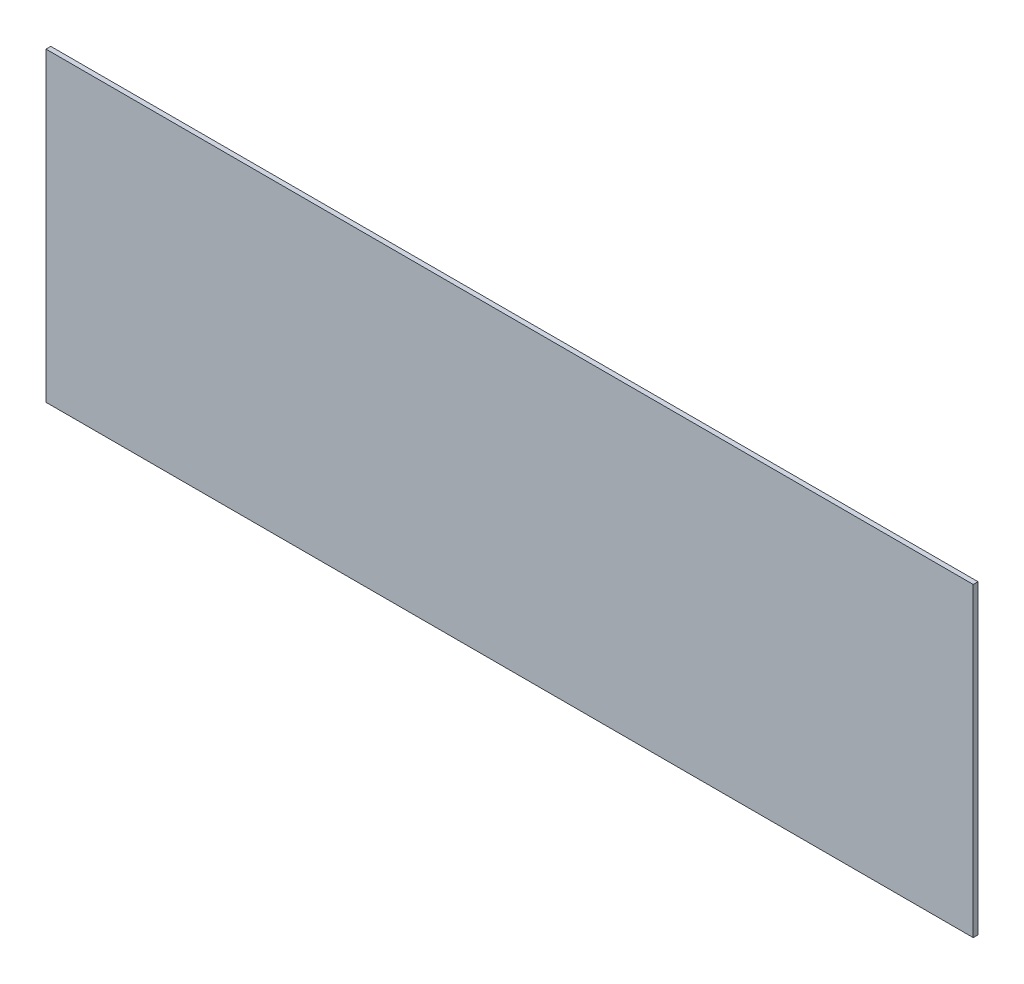
from build123d import *

# Parameters (mm, degrees)
SKETCH1_W           = 615.95
SKETCH1_H           = 203.2
BOSS_EXTRUDE1_DEPTH = 3.175


with BuildPart() as part:
    # Sketch1 → Boss-Extrude1 (new body)
    with BuildSketch(Plane.XY):
        Rectangle(SKETCH1_W, SKETCH1_H)
    extrude(amount=BOSS_EXTRUDE1_DEPTH)


solid = part.part
